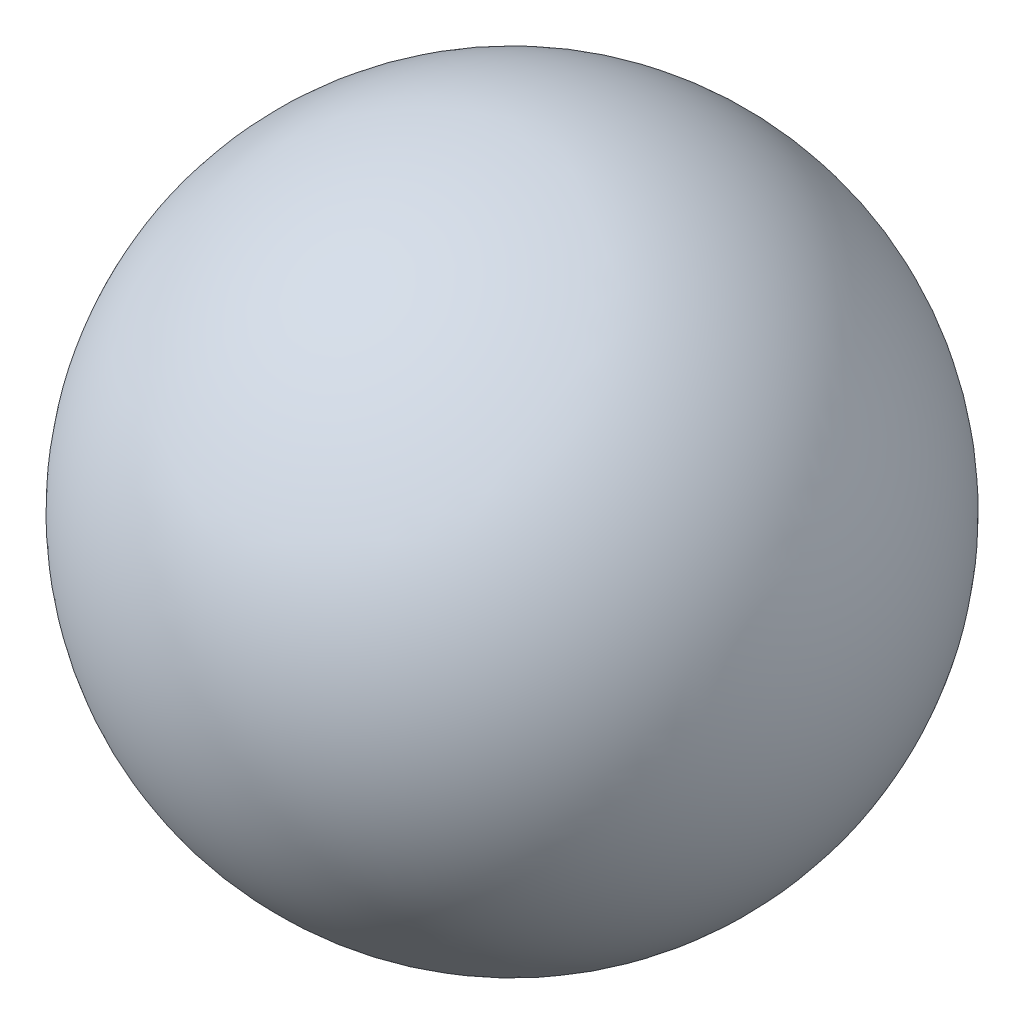
from build123d import *


with BuildPart() as part:
    # Schizzo1 → Rivoluzione5 (revolve)
    with BuildSketch(Plane.XY):
        with BuildLine():
            Line((-17, 0), (17, 0))
            ThreePointArc((17, 0), (0, 17), (-17, 0))
        make_face()
    revolve(axis=Axis((18.7, 0, 0), (-1, 0, 0)))


solid = part.part
